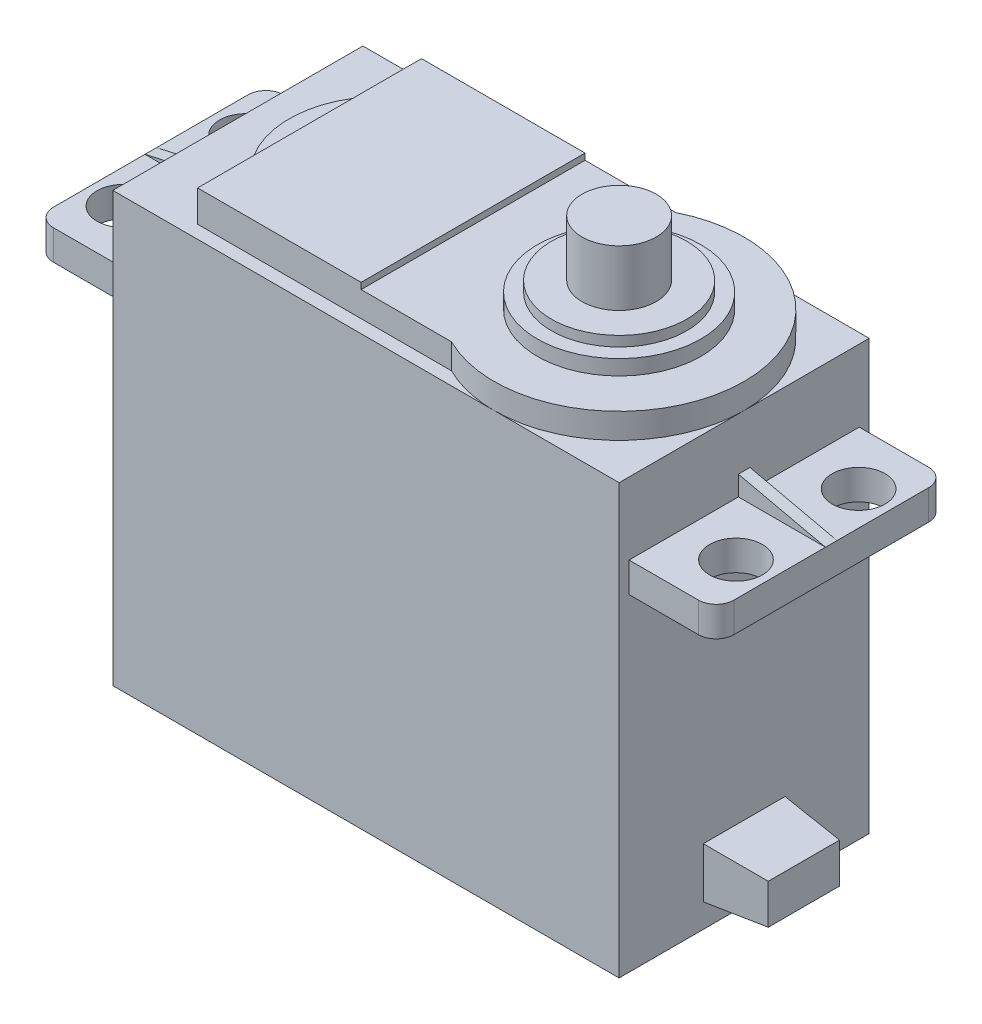
from build123d import *

# Parameters (mm, degrees)
SKETCH1_R           = 2.1
BOSS_EXTRUDE1_DEPTH = 2.38
BOSS_EXTRUDE2_START = 2.38
SKETCH1_3_W         = 40.25
SKETCH1_3_H         = 19.88
SKETCH1_3_W_2       = 6.925
SKETCH1_3_H_2       = 0.92
BOSS_EXTRUDE2_DEPTH = 5.72
BOSS_EXTRUDE3_START = 8.1
BOSS_EXTRUDE3_DEPTH = 2
BOSS_EXTRUDE4_START = 10.1
BOSS_EXTRUDE4_DEPTH = 0.5
BOSS_EXTRUDE5_START = 10.1
SKETCH1_6_R         = 6.5
BOSS_EXTRUDE5_DEPTH = 1.2
BOSS_EXTRUDE6_START = 10.1
SKETCH1_8_R         = 5.375
BOSS_EXTRUDE6_DEPTH = 2
BOSS_EXTRUDE7_START = 10.1
SKETCH1_9_R         = 2.95
BOSS_EXTRUDE7_DEPTH = 6.45
SKETCH1_10_W        = 40.25
SKETCH1_10_H        = 19.88
BOSS_EXTRUDE8_DEPTH = 28
CHAMFER1_SIZE       = 2
SKETCH2_W           = 6.5
SKETCH2_H           = 4
BOSS_EXTRUDE9_DEPTH = 4.75
BOSS_EXTRUDE9_TAPER = 5
CUT_EXTRUDE1_DEPTH  = 44.714035503


with BuildPart() as part:
    # Sketch1 → Boss-Extrude1 (new body)
    with BuildSketch(Plane(origin=(0, 0, 0), x_dir=(1, 0, 0), z_dir=(0, 1, 0))):
        with BuildLine():
            Line((-20.125, -9.15), (-20.125, -9.94))
            Line((-20.125, -9.94), (20.125, -9.94))
            Line((20.125, -9.94), (20.125, -9.15))
            Line((20.125, -9.15), (25.635786438, -9.15))
            ThreePointArc((25.635786438, -9.15), (26.635786438, -8.735786438), (27.05, -7.735786438))
            Line((27.05, -7.735786438), (27.05, 7.735786438))
            ThreePointArc((27.05, 7.735786438), (26.635786438, 8.735786438), (25.635786438, 9.15))
            Line((25.635786438, 9.15), (20.125, 9.15))
            Line((20.125, 9.15), (20.125, 9.94))
            Line((20.125, 9.94), (-20.125, 9.94))
            Line((-20.125, 9.94), (-20.125, 9.15))
            Line((-20.125, 9.15), (-25.635786438, 9.15))
            ThreePointArc((-25.635786438, 9.15), (-26.635786438, 8.735786438), (-27.05, 7.735786438))
            Line((-27.05, 7.735786438), (-27.05, -7.735786438))
            ThreePointArc((-27.05, -7.735786438), (-26.635786438, -8.735786438), (-25.635786438, -9.15))
            Line((-25.635786438, -9.15), (-20.125, -9.15))
        make_face()
        with BuildLine():
            ThreePointArc((-14.425, -4.627785648), (-16.045, 0), (-14.425, 4.627785648))
            Line((-14.425, 4.627785648), (-14.425, -4.627785648))
        make_face(mode=Mode.SUBTRACT)
        with Locations(Location((-24.35, -4.875, 0), (0, 0, 270))):
            Circle(SKETCH1_R, mode=Mode.SUBTRACT)
        with Locations(Location((24.35, -4.875, 0), (0, 0, 270))):
            Circle(SKETCH1_R, mode=Mode.SUBTRACT)
        with Locations(Location((-24.35, 4.875, 0), (0, 0, 270))):
            Circle(SKETCH1_R, mode=Mode.SUBTRACT)
        with Locations(Location((24.35, 4.875, 0), (0, 0, 270))):
            Circle(SKETCH1_R, mode=Mode.SUBTRACT)
    extrude(amount=BOSS_EXTRUDE1_DEPTH)

    # Sketch1<3> → Boss-Extrude2 (add)
    with BuildSketch(Plane(origin=(0, 0, 0), x_dir=(1, 0, 0), z_dir=(0, 1, 0)).offset(BOSS_EXTRUDE2_START)):
        Rectangle(SKETCH1_3_W, SKETCH1_3_H)
        with Locations((-23.5875, 0)):
            Rectangle(SKETCH1_3_W_2, SKETCH1_3_H_2)
        with Locations((23.5875, 0)):
            Rectangle(SKETCH1_3_W_2, SKETCH1_3_H_2)
    extrude(amount=BOSS_EXTRUDE2_DEPTH)

    # Sketch1<4> → Boss-Extrude3 (add)
    with BuildSketch(Plane(origin=(0, 0, 0), x_dir=(1, 0, 0), z_dir=(0, 1, 0)).offset(BOSS_EXTRUDE3_START)):
        with BuildLine():
            Line((5.758534141, 8.9), (-14.425, 8.9))
            Line((-14.425, 8.9), (-14.425, 4.627785648))
            ThreePointArc((-14.425, 4.627785648), (-16.045, 0), (-14.425, -4.627785648))
            Line((-14.425, -4.627785648), (-14.425, -8.9))
            Line((-14.425, -8.9), (5.758534141, -8.9))
            ThreePointArc((5.758534141, -8.9), (20.125, 0), (5.758534141, 8.9))
        make_face()
    extrude(amount=BOSS_EXTRUDE3_DEPTH)

    # Sketch1<5> → Boss-Extrude4 (add)
    with BuildSketch(Plane(origin=(0, 0, 0), x_dir=(1, 0, 0), z_dir=(0, 1, 0)).offset(BOSS_EXTRUDE4_START)):
        Polygon((-14.425, -8.9), (-1.425, -8.9), (-1.425, 8.9), (-14.425, 8.9), (-14.425, 4.627785648), (-14.425, -4.627785648), align=None)
    extrude(amount=BOSS_EXTRUDE4_DEPTH)

    # Sketch1<6> → Boss-Extrude5 (add)
    with BuildSketch(Plane(origin=(0, 0, 0), x_dir=(1, 0, 0), z_dir=(0, 1, 0)).offset(BOSS_EXTRUDE5_START)):
        with Locations(Location((10.185, 0, 0), (0, 0, 90))):
            Circle(SKETCH1_6_R)
    extrude(amount=BOSS_EXTRUDE5_DEPTH)

    # Sketch1<8> → Boss-Extrude6 (add)
    with BuildSketch(Plane(origin=(0, 0, 0), x_dir=(1, 0, 0), z_dir=(0, 1, 0)).offset(BOSS_EXTRUDE6_START)):
        with Locations(Location((10.185, 0, 0), (0, 0, 90))):
            Circle(SKETCH1_8_R)
    extrude(amount=BOSS_EXTRUDE6_DEPTH)

    # Sketch1<9> → Boss-Extrude7 (add)
    with BuildSketch(Plane(origin=(0, 0, 0), x_dir=(1, 0, 0), z_dir=(0, 1, 0)).offset(BOSS_EXTRUDE7_START)):
        with Locations(Location((10.185, 0, 0), (0, 0, 90))):
            Circle(SKETCH1_9_R)
    extrude(amount=BOSS_EXTRUDE7_DEPTH)

    # Sketch1<10> → Boss-Extrude8 (add)
    with BuildSketch(Plane(origin=(0, 0, 0), x_dir=(1, 0, 0), z_dir=(0, 1, 0))):
        Rectangle(SKETCH1_10_W, SKETCH1_10_H)
    extrude(amount=-BOSS_EXTRUDE8_DEPTH)

    # Chamfer1
    chamfer1_edges = [part.edges().sort_by_distance(p)[0] for p in [
        (0, -28, 9.94),
        (20.125, -28, 0),
        (-20.125, -28, 0),
        (0, -28, -9.94),
    ]]
    chamfer(chamfer1_edges, length=CHAMFER1_SIZE)

    # Sketch2 → Boss-Extrude9 (add)
    with BuildSketch(Plane(origin=(20.125, 0, 0), x_dir=(0, 0, -1), z_dir=(1, 0, 0))):
        with Locations((0, -22.1)):
            Rectangle(SKETCH2_W, SKETCH2_H)
    extrude(amount=BOSS_EXTRUDE9_DEPTH, taper=BOSS_EXTRUDE9_TAPER)

    # Sketch3 → Cut-Extrude1 (cut, through all)
    with BuildSketch(Plane(origin=(0, 0, -9.94), x_dir=(-1, 0, 0), z_dir=(0, 0, -1))):
        Polygon((-27.05, 8.1), (-27.05, 2.38), (-20.125, 3.95), (-20.125, 8.1), align=None)
        Polygon((20.125, 3.95), (27.05, 2.38), (27.05, 8.1), (20.125, 8.1), align=None)
    extrude(amount=-CUT_EXTRUDE1_DEPTH, mode=Mode.SUBTRACT)


solid = part.part
